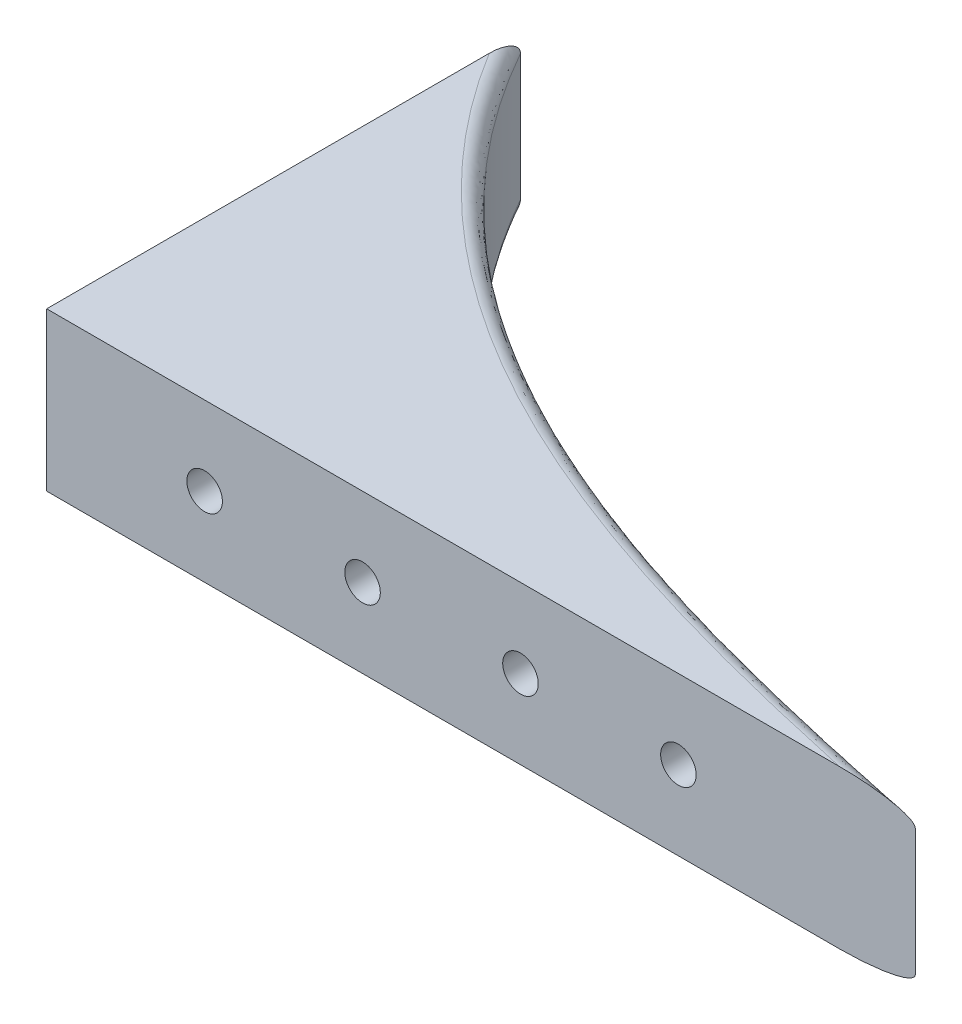
from build123d import *

# Parameters (mm, degrees)
BOSS_EXTRUDE1_DEPTH = 20
SKETCH3_R           = 2.5
CUT_EXTRUDE1_DEPTH  = 101.912910248
SKETCH4_R           = 2.5
BOSS_EXTRUDE2_DEPTH = 5
SKETCH5_R           = 2.25
CUT_EXTRUDE2_DEPTH  = 101.912910248
FILLET2_R           = 2


with BuildPart() as part:
    # Sketch2 → Boss-Extrude1 (new body)
    with BuildSketch(Plane(origin=(0, 0, 0), x_dir=(1, 0, 0), z_dir=(0, 1, 0))):
        with BuildLine():
            Line((-31.365303949, 0), (78.634696051, 0))
            add(Edge.make_bspline(
                [(-31.365303949, 60), (-8.421867165, 19.05257491), (40.3762891, 8.008963313), (78.634696051, 0)],
                knots=[0, 0, 0, 0, 1, 1, 1, 1], degree=3))
            Line((-31.365303949, 60), (-31.365303949, 0))
        make_face()
    extrude(amount=BOSS_EXTRUDE1_DEPTH)

    # Sketch3 → Cut-Extrude1 (cut, through all)
    with BuildSketch(Plane.XY):
        with Locations((-11.365303949, 10)):
            Circle(SKETCH3_R)
        with Locations((8.634696051, 10)):
            Circle(SKETCH3_R)
        with Locations((28.634696051, 10)):
            Circle(SKETCH3_R)
        with Locations((48.634696051, 10)):
            Circle(SKETCH3_R)
    extrude(amount=-CUT_EXTRUDE1_DEPTH, mode=Mode.SUBTRACT)

    # Sketch4 → Boss-Extrude2 (add)
    with BuildSketch(Plane.XY):
        with Locations((-11.365303949, 10)):
            Circle(SKETCH4_R)
        with Locations((8.634696051, 10)):
            Circle(SKETCH4_R)
        with Locations((28.634696051, 10)):
            Circle(SKETCH4_R)
        with Locations((48.634696051, 10)):
            Circle(SKETCH4_R)
    extrude(amount=-BOSS_EXTRUDE2_DEPTH)

    # Sketch5 → Cut-Extrude2 (cut, through all)
    with BuildSketch(Plane.XY):
        with Locations((-11.365303949, 10)):
            Circle(SKETCH5_R)
        with Locations((8.634696051, 10)):
            Circle(SKETCH5_R)
        with Locations((28.634696051, 10)):
            Circle(SKETCH5_R)
        with Locations((48.634696051, 10)):
            Circle(SKETCH5_R)
    extrude(amount=-CUT_EXTRUDE2_DEPTH, mode=Mode.SUBTRACT)

    # Fillet2
    fillet2_edges = [part.edges().sort_by_distance(p)[0] for p in [
        (16.640660288, 20, -18.214380109),
        (16.640660288, 0, -18.214380109),
    ]]
    fillet(fillet2_edges, radius=FILLET2_R)


solid = part.part
